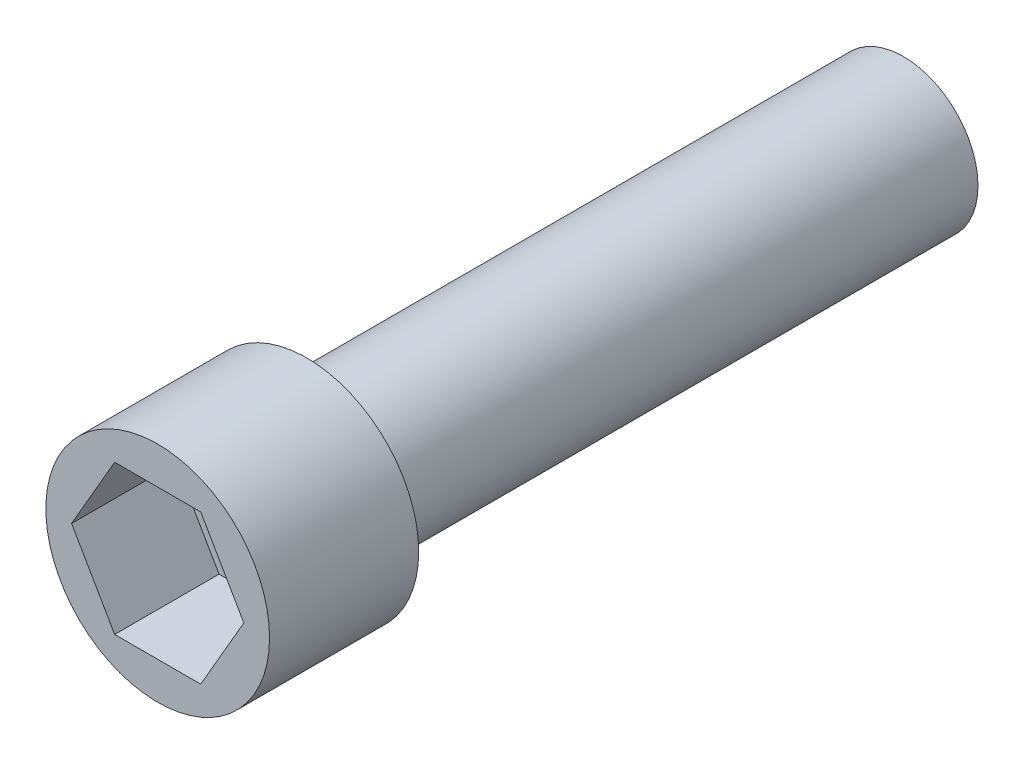
from build123d import *

# Parameters (mm, degrees)
SKETCH1_R               = 7.5
BOSS_EXTRUDE1_DEPTH     = 10
BOSS_EXTRUDE2_DEPTH     = 50
CUT_EXTRUDE1_DEPTH      = 52.112620751
CUT_EXTRUDE1_DEPTH_BACK = 7


with BuildPart() as part:
    # Sketch1 → Boss-Extrude1 (new body)
    with BuildSketch(Plane.XY):
        Circle(SKETCH1_R)
    extrude(amount=-BOSS_EXTRUDE1_DEPTH)

    # Sketch1<4> → Boss-Extrude2 (add)
    with BuildSketch(Plane.XY):
        with BuildLine():
            ThreePointArc((5, 0), (4.829629147, 1.294095167), (4.330127079, 2.499999895))
            ThreePointArc((4.330127079, 2.499999895), (2.500000052, 4.330126989), (0, 5))
            ThreePointArc((0, 5), (-2.500000054, 4.330126988), (-4.330127081, 2.499999892))
            ThreePointArc((-4.330127081, 2.499999892), (-5, 0), (-4.330127081, -2.499999892))
            ThreePointArc((-4.330127081, -2.499999892), (-2.500000049, -4.330126991), (1.2e-08, -5))
            ThreePointArc((1.2e-08, -5), (2.5, -4.330127019), (4.330127013, -2.500000011))
            ThreePointArc((4.330127013, -2.500000011), (4.82962913, -1.294095231), (5, 0))
        make_face()
    extrude(amount=-BOSS_EXTRUDE2_DEPTH)

    # Sketch1<5> → Cut-Extrude1 (cut, two sides: drawn at the far end of the back side and taken through both)
    with BuildSketch(Plane.XY.offset(-CUT_EXTRUDE1_DEPTH_BACK)):
        Polygon((5.773502692, 0), (2.886751346, 5), (-2.886751346, 5), (-5.773502692, 0), (-2.886751346, -5), (2.886751346, -5), align=None)
    extrude(amount=CUT_EXTRUDE1_DEPTH + CUT_EXTRUDE1_DEPTH_BACK, mode=Mode.SUBTRACT)


solid = part.part
